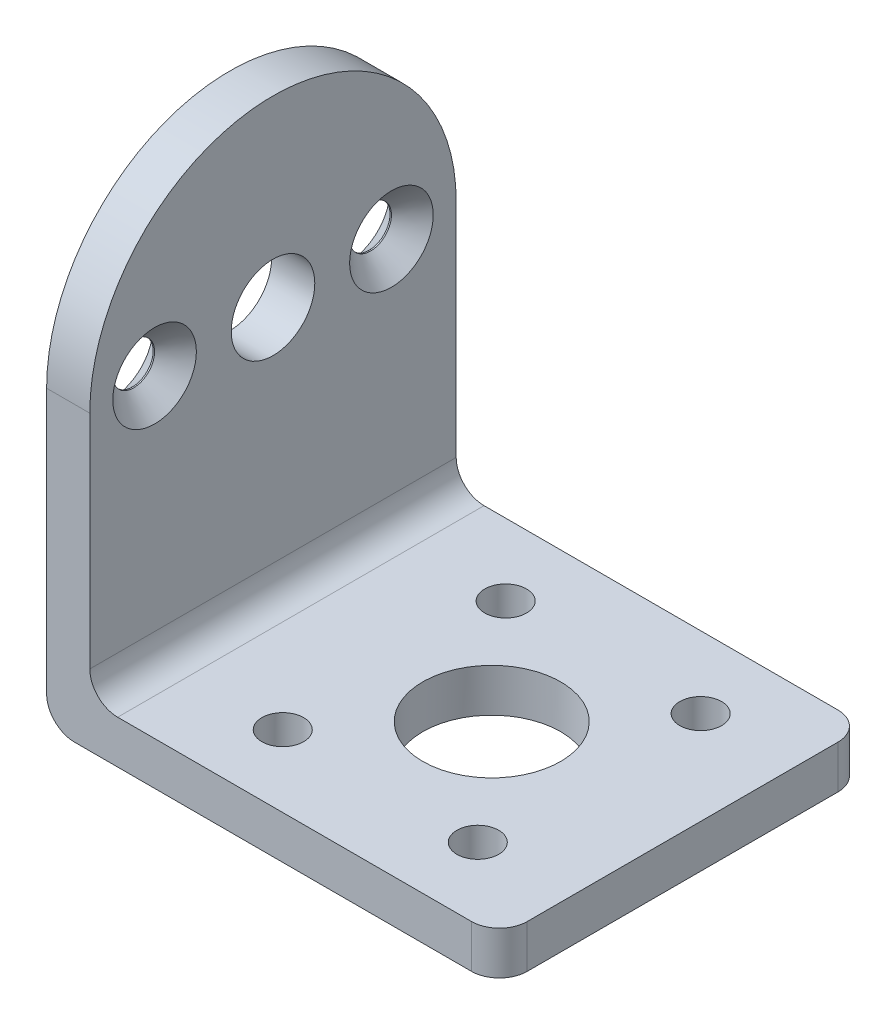
from build123d import *

# Parameters (mm, degrees)
SKETCH1_W           = 32.5
SKETCH1_H           = 26.3
BOSS_EXTRUDE1_DEPTH = 3.1
SKETCH2_W           = 3.1
SKETCH2_H           = 26.3
BOSS_EXTRUDE2_DEPTH = 17.9
BOSS_EXTRUDE3_DEPTH = 3.1
FILLET1_R           = 2
SKETCH4_R           = 3
SKETCH4_R_2         = 1.5
CUT_EXTRUDE1_DEPTH  = 3.1
CHAMFER1_SIZE       = 1.5
SKETCH5_R           = 4.95
SKETCH5_R_2         = 1.5
CUT_EXTRUDE2_DEPTH  = 25


with BuildPart() as part:
    # Sketch1 → Boss-Extrude1 (new body)
    with BuildSketch(Plane(origin=(0, 0, 0), x_dir=(1, 0, 0), z_dir=(0, 1, 0))):
        with Locations((16.25, 13.15)):
            Rectangle(SKETCH1_W, SKETCH1_H)
    extrude(amount=BOSS_EXTRUDE1_DEPTH)

    # Sketch2 → Boss-Extrude2 (add)
    with BuildSketch(Plane(origin=(0, 3.1, 0), x_dir=(1, 0, 0), z_dir=(0, 1, 0))):
        with Locations((1.55, 13.15)):
            Rectangle(SKETCH2_W, SKETCH2_H)
    extrude(amount=BOSS_EXTRUDE2_DEPTH)

    # Sketch3 → Boss-Extrude3 (add)
    with BuildSketch(Plane(origin=(3.1, 0, 0), x_dir=(0, 0, -1), z_dir=(1, 0, 0))):
        with BuildLine():
            Line((0, 21), (26.3, 21))
            ThreePointArc((26.3, 21), (13.15, 34.15), (0, 21))
        make_face()
    extrude(amount=-BOSS_EXTRUDE3_DEPTH)

    # Fillet1
    fillet1_edges = [part.edges().sort_by_distance(p)[0] for p in [
        (3.1, 3.1, -13.15),
        (0, 0, -13.15),
        (32.5, 1.55, -26.3),
        (32.5, 1.55, 0),
    ]]
    fillet(fillet1_edges, radius=FILLET1_R)

    # Sketch4 → Cut-Extrude1 (cut)
    with BuildSketch(Plane(origin=(3.1, 0, 0), x_dir=(0, 0, -1), z_dir=(1, 0, 0))):
        with Locations((13.15, 21)):
            Circle(SKETCH4_R)
        with Locations((21.65, 21)):
            Circle(SKETCH4_R_2)
        with Locations((4.65, 21)):
            Circle(SKETCH4_R_2)
    extrude(amount=-CUT_EXTRUDE1_DEPTH, mode=Mode.SUBTRACT)

    # Chamfer1
    chamfer1_edges = [part.edges().sort_by_distance(p)[0] for p in [
        (0, 21, -20.15),
        (0, 21, -3.15),
        (3.1, 21, -20.15),
        (3.1, 21, -3.15),
    ]]
    chamfer(chamfer1_edges, length=CHAMFER1_SIZE)

    # Sketch5 → Cut-Extrude2 (cut)
    with BuildSketch(Plane(origin=(0, 3.1, 0), x_dir=(1, 0, 0), z_dir=(0, 1, 0))):
        with Locations((18.8, 13.15)):
            Circle(SKETCH5_R)
        with Locations((25.8, 21.15)):
            Circle(SKETCH5_R_2)
        with Locations((25.8, 5.15)):
            Circle(SKETCH5_R_2)
        with Locations((11.8, 21.15)):
            Circle(SKETCH5_R_2)
        with Locations((11.8, 5.15)):
            Circle(SKETCH5_R_2)
    extrude(amount=-CUT_EXTRUDE2_DEPTH, mode=Mode.SUBTRACT)


solid = part.part
